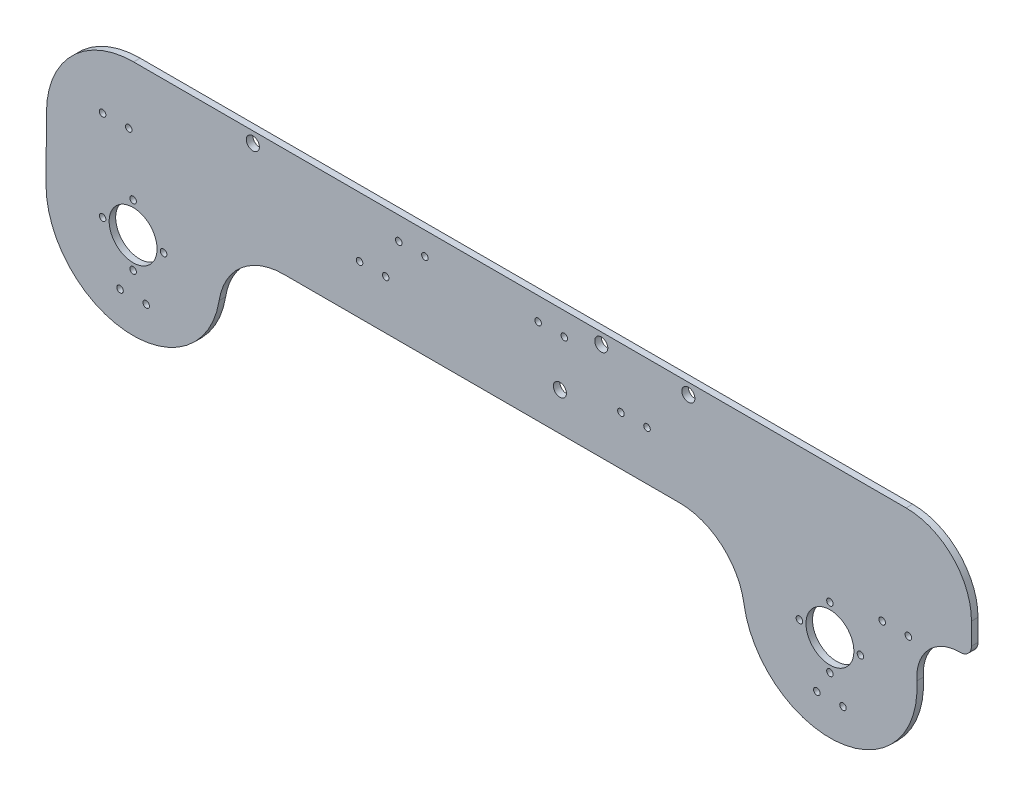
from build123d import *

# Parameters (mm, degrees)
MODEL_R         = 1.5
MODEL_R_2       = 11
MODEL_R_3       = 3
EXTRUDE_1_DEPTH = 3


with BuildPart() as part:
    # Model → 凸台-拉伸1 (new body)
    with BuildSketch(Plane.XY):
        with BuildLine():
            ThreePointArc((39.503035275, -6.285714286), (49.655052701, 11.819164878), (69.130311731, 19))
            Line((69.130311731, 19), (250.869688269, 19))
            ThreePointArc((250.869688269, 19), (270.344947299, 11.819164878), (280.496964725, -6.285714286))
            ThreePointArc((280.496964725, -6.285714286), (324.480836134, -39.748234018), (359.911012126, 2.666666667))
            ThreePointArc((359.911012126, 2.666666667), (365.260583322, 17.662601021), (379.866518188, 24))
            Line((379.866518188, 24), (380, 24))
            ThreePointArc((380, 24), (383.535533906, 25.464466094), (385, 29))
            Line((385, 29), (385, 38.996919308))
            ThreePointArc((385, 38.996919308), (376.213203436, 60.210122744), (355, 68.996919308))
            Line((355, 68.996919308), (0.221994544, 68.996919308))
            ThreePointArc((0.221994544, 68.996919308), (-28.062276703, 57.281190556), (-39.778005456, 28.996919308))
            Line((-39.778005456, 28.996919308), (-39.995311376, 0.612427911))
            Line((-39.995311376, 0.612427911), (-40, 0))
            ThreePointArc((-40, 0), (-3.152664667, -39.875565269), (39.503035275, -6.285714286))
        make_face()
        with Locations((-6, -24.5)):
            Circle(MODEL_R, mode=Mode.SUBTRACT)
        with Locations((6, -24.5)):
            Circle(MODEL_R, mode=Mode.SUBTRACT)
        with Locations((0, -14)):
            Circle(MODEL_R, mode=Mode.SUBTRACT)
        with Locations((-14, 0)):
            Circle(MODEL_R, mode=Mode.SUBTRACT)
        Circle(MODEL_R_2, mode=Mode.SUBTRACT)
        with Locations((14, 0)):
            Circle(MODEL_R, mode=Mode.SUBTRACT)
        with Locations((0, 14)):
            Circle(MODEL_R, mode=Mode.SUBTRACT)
        with Locations((314, -24.5)):
            Circle(MODEL_R, mode=Mode.SUBTRACT)
        with Locations((326, -24.5)):
            Circle(MODEL_R, mode=Mode.SUBTRACT)
        with Locations((320, -14)):
            Circle(MODEL_R, mode=Mode.SUBTRACT)
        with Locations((306, 0)):
            Circle(MODEL_R, mode=Mode.SUBTRACT)
        with Locations((320, 0)):
            Circle(MODEL_R_2, mode=Mode.SUBTRACT)
        with Locations((334, 0)):
            Circle(MODEL_R, mode=Mode.SUBTRACT)
        with Locations((320, 14)):
            Circle(MODEL_R, mode=Mode.SUBTRACT)
        with Locations((-14, 41.5)):
            Circle(MODEL_R, mode=Mode.SUBTRACT)
        with Locations((-2, 41.5)):
            Circle(MODEL_R, mode=Mode.SUBTRACT)
        with Locations((104, 41.5)):
            Circle(MODEL_R, mode=Mode.SUBTRACT)
        with Locations((116, 41.5)):
            Circle(MODEL_R, mode=Mode.SUBTRACT)
        with Locations((54.983182049, 63.996919308)):
            Circle(MODEL_R_3, mode=Mode.SUBTRACT)
        with Locations((122, 58.496919308)):
            Circle(MODEL_R, mode=Mode.SUBTRACT)
        with Locations((134, 58.496919308)):
            Circle(MODEL_R, mode=Mode.SUBTRACT)
        with Locations((196, 36.5)):
            Circle(MODEL_R_3, mode=Mode.SUBTRACT)
        with Locations((224, 41.5)):
            Circle(MODEL_R, mode=Mode.SUBTRACT)
        with Locations((236, 41.5)):
            Circle(MODEL_R, mode=Mode.SUBTRACT)
        with Locations((344, 18.5)):
            Circle(MODEL_R, mode=Mode.SUBTRACT)
        with Locations((356, 18.5)):
            Circle(MODEL_R, mode=Mode.SUBTRACT)
        with Locations((186, 58.496919308)):
            Circle(MODEL_R, mode=Mode.SUBTRACT)
        with Locations((198, 58.496919308)):
            Circle(MODEL_R, mode=Mode.SUBTRACT)
        with Locations((215, 63.996919308)):
            Circle(MODEL_R_3, mode=Mode.SUBTRACT)
        with Locations((255, 63.996919308)):
            Circle(MODEL_R_3, mode=Mode.SUBTRACT)
    extrude(amount=EXTRUDE_1_DEPTH)


solid = part.part
